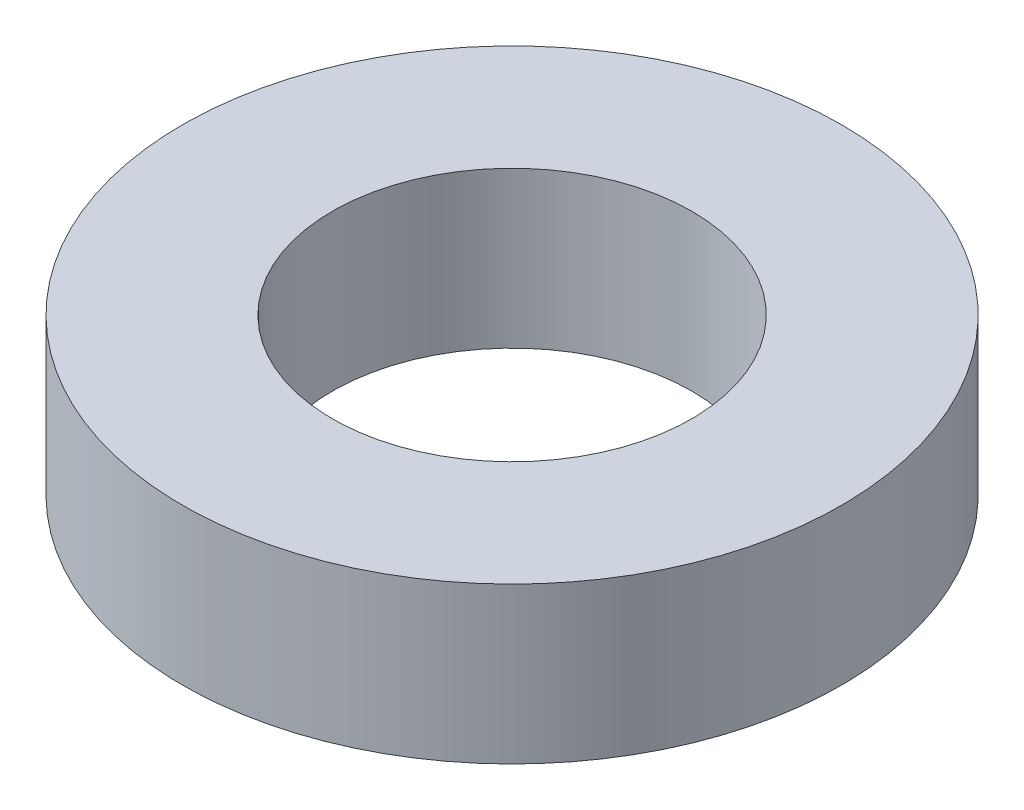
from build123d import *

# Parameters (mm, degrees)
SKETCH1_R           = 27.5
SKETCH1_R_2         = 15
BOSS_EXTRUDE1_DEPTH = 13


with BuildPart() as part:
    # Sketch1 → Boss-Extrude1 (new body)
    with BuildSketch(Plane(origin=(0, 0, 0), x_dir=(1, 0, 0), z_dir=(0, 1, 0))):
        with Locations(Location((0, 0, 0), (0, 0, 90))):
            Circle(SKETCH1_R)
        with Locations(Location((0, 0, 0), (0, 0, 90))):
            Circle(SKETCH1_R_2, mode=Mode.SUBTRACT)
    extrude(amount=BOSS_EXTRUDE1_DEPTH)


solid = part.part
